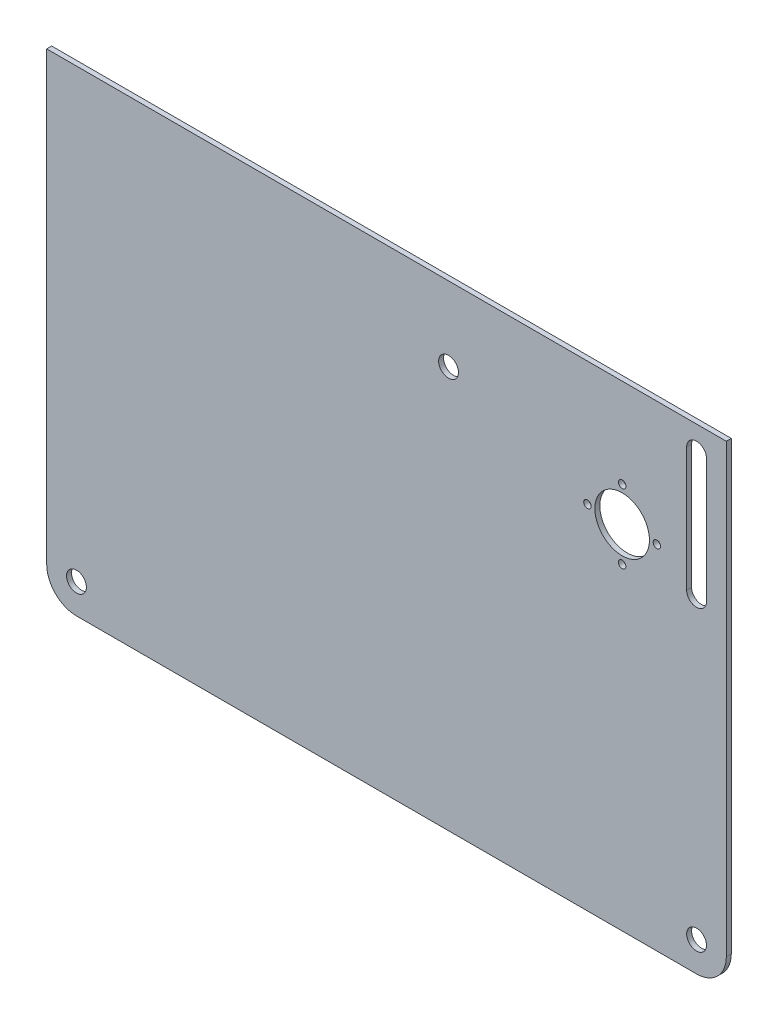
from build123d import *

# Parameters (mm, degrees)
SKETCH1_R           = 4
SKETCH1_R_2         = 1.5
SKETCH1_R_3         = 11
BOSS_EXTRUDE1_DEPTH = 2


with BuildPart() as part:
    # Sketch1 → Boss-Extrude1 (new body)
    with BuildSketch(Plane.XY):
        with BuildLine():
            ThreePointArc((-137, 0), (-133.485281374, -8.485281374), (-125, -12))
            Line((-125, -12), (125, -12))
            ThreePointArc((125, -12), (133.485281374, -8.485281374), (137, 0))
            Line((137, 0), (137, 180))
            Line((137, 180), (-53.998245329, 180))
            Line((-53.998245329, 180), (-137, 180))
            Line((-137, 180), (-137, 0))
        make_face()
        with Locations((-125, 0)):
            Circle(SKETCH1_R, mode=Mode.SUBTRACT)
        with Locations((125, 0)):
            Circle(SKETCH1_R, mode=Mode.SUBTRACT)
        with Locations((95, 116)):
            Circle(SKETCH1_R_2, mode=Mode.SUBTRACT)
        with Locations((81, 130)):
            Circle(SKETCH1_R_2, mode=Mode.SUBTRACT)
        with Locations((95, 130)):
            Circle(SKETCH1_R_3, mode=Mode.SUBTRACT)
        with Locations((109, 130)):
            Circle(SKETCH1_R_2, mode=Mode.SUBTRACT)
        with Locations((25, 150)):
            Circle(SKETCH1_R, mode=Mode.SUBTRACT)
        with Locations((95, 144)):
            Circle(SKETCH1_R_2, mode=Mode.SUBTRACT)
        with BuildLine():
            ThreePointArc((129, 120), (125, 116), (121, 120))
            Line((121, 120), (121, 170))
            ThreePointArc((121, 170), (125, 174), (129, 170))
            Line((129, 170), (129, 120))
        make_face(mode=Mode.SUBTRACT)
    extrude(amount=BOSS_EXTRUDE1_DEPTH)


solid = part.part
